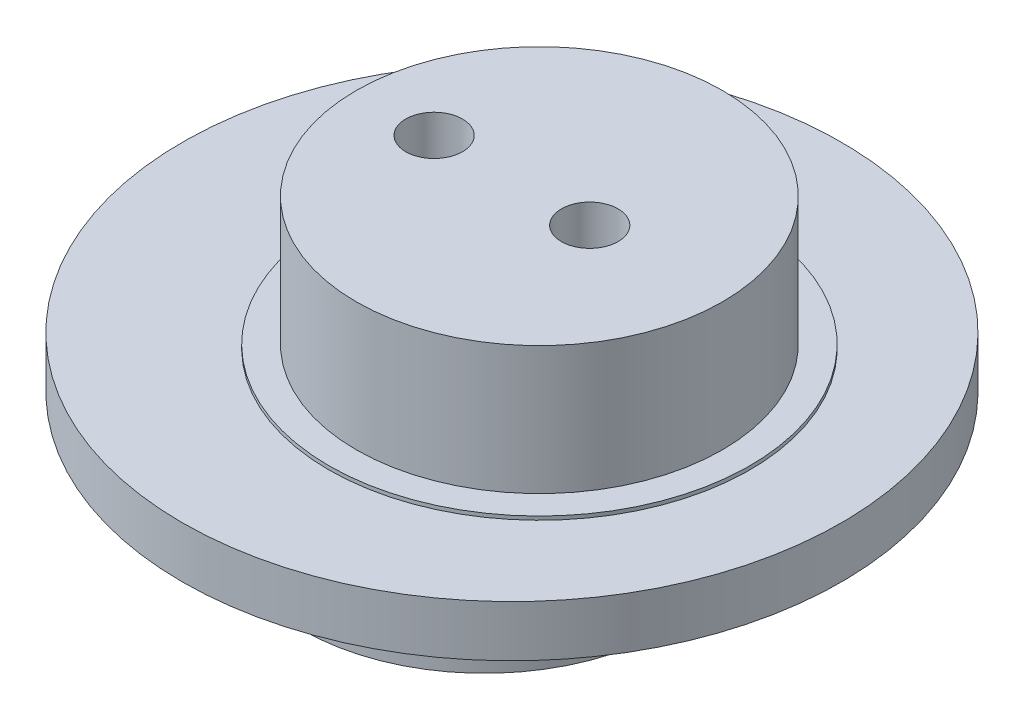
from build123d import *

# Parameters (mm, degrees)
SKIZZE1_R                        = 18
AUFSATZ_LINEAR_AUSTRAGEN1_DEPTH  = 2.8
SKIZZE2_R                        = 11.5
AUFSATZ_LINEAR_AUSTRAGEN2_DEPTH  = 0.2
SKIZZE3_R                        = 10
AUFSATZ_LINEAR_AUSTRAGEN3_DEPTH  = 7
SKIZZE4_R                        = 10
AUFSATZ_LINEAR_AUSTRAGEN4_DEPTH  = 7
F_3_1_3_1_DURCHMESSER_BOHRUNG1_D = 3.1


with BuildPart() as part:
    # Skizze1 → Aufsatz-Linear austragen1 (new body)
    with BuildSketch(Plane(origin=(0, 0, 0), x_dir=(1, 0, 0), z_dir=(0, 1, 0))):
        with Locations(Location((0, 0, 0), (0, 0, 270))):
            Circle(SKIZZE1_R)
    extrude(amount=AUFSATZ_LINEAR_AUSTRAGEN1_DEPTH)

    # Skizze2 → Aufsatz-Linear austragen2 (add)
    with BuildSketch(Plane(origin=(0, 2.8, 0), x_dir=(1, 0, 0), z_dir=(0, 1, 0))):
        with Locations(Location((1.5, 0, 0), (0, 0, 270))):
            Circle(SKIZZE2_R)
    extrude(amount=AUFSATZ_LINEAR_AUSTRAGEN2_DEPTH)

    # Skizze3 → Aufsatz-Linear austragen3 (add)
    with BuildSketch(Plane(origin=(0, 3, 0), x_dir=(1, 0, 0), z_dir=(0, 1, 0))):
        with Locations(Location((1.5, 0, 0), (0, 0, 270))):
            Circle(SKIZZE3_R)
    extrude(amount=AUFSATZ_LINEAR_AUSTRAGEN3_DEPTH)

    # Skizze4 → Aufsatz-Linear austragen4 (add)
    with BuildSketch(Plane.XZ):
        with Locations(Location((-1.5, 0, 0), (0, 0, 270))):
            Circle(SKIZZE4_R)
    extrude(amount=AUFSATZ_LINEAR_AUSTRAGEN4_DEPTH)

    # Ø3.1 (3.1) Durchmesser Bohrung1 (through all)
    with Locations(Plane(origin=(0, 10, 0), x_dir=(1, 0, 0), z_dir=(0, 1, 0))):
        with Locations((4.25, 0), (-4.25, 0)):
            Hole(F_3_1_3_1_DURCHMESSER_BOHRUNG1_D / 2)


solid = part.part
